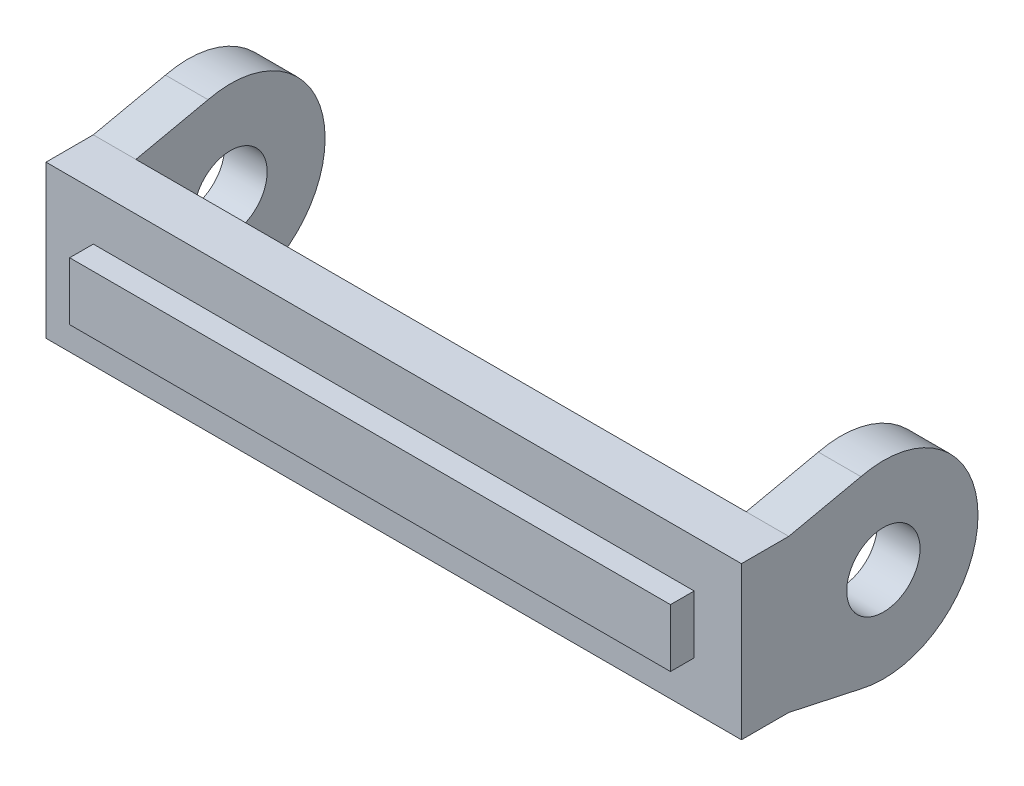
from build123d import *

# Parameters (mm, degrees)
CROQUIS1_W                 = 26.4
CROQUIS1_H                 = 2.95
SALIENTE_EXTRUIR1_DEPTH    = 1.5
SALIENTE_EXTRUIR2_DEPTH    = 1
SALIENTE_EXTRUIR3_START    = 1
SALIENTE_EXTRUIR3_DEPTH    = 1
CROQUIS5_W                 = 26.4
CROQUIS5_H                 = 0.387649526
SALIENTE_EXTRUIR4_DEPTH    = 2.95
CROQUIS7_R                 = 1.5
CORTAR_EXTRUIR1_DEPTH      = 51
CORTAR_EXTRUIR2_START      = 26.4
CROQUIS8_R                 = 3
CORTAR_EXTRUIR2_DEPTH      = 26.4
CROQUIS9_W                 = 0.5
CROQUIS9_H                 = 1
SALIENTE_EXTRUIR5_DEPTH    = 20
CROQUIS11_W                = 1
CROQUIS11_H                = 1.007194245
CROQUIS11_H_2              = 16.042805755
CORTAR_EXTRUIR3_DEPTH      = 40
CROQUIS13_W                = 25.4
CROQUIS13_H                = 2.45
SALIENTE_EXTRUIR6_DEPTH    = 1
CROQUIS14_W                = 4.527159606
CROQUIS14_H                = 1.589204257
CROQUIS14_W_2              = 3.32574087
CROQUIS14_H_2              = 2.189079922
CORTAR_EXTRUIR4_DEPTH      = 21
CORTAR_EXTRUIR5_DEPTH      = 21
CORTAR_EXTRUIR5_DEPTH_BACK = 21
CROQUIS16_W                = 34.398488571
CROQUIS16_H                = 9.421589472
CROQUIS17_W                = 29.4
CROQUIS17_H                = 6.45
SALIENTE_EXTRUIR7_DEPTH    = 2
CROQUIS18_R                = 1.55
SALIENTE_EXTRUIR8_DEPTH    = 29.4
CORTAR_EXTRUIR6_DEPTH      = 12
CORTAR_EXTRUIR6_DEPTH_BACK = 32
CROQUIS19_W                = 25.8
CROQUIS19_H                = 10.578979108


with BuildPart() as part:
    # Croquis1 → Saliente-Extruir1 (new body)
    with BuildSketch(Plane.XY):
        with Locations((-22.767073783, 17.517805755)):
            Rectangle(CROQUIS1_W, CROQUIS1_H)
    extrude(amount=SALIENTE_EXTRUIR1_DEPTH)

    # Croquis2 → Saliente-Extruir2 (add)
    with BuildSketch(Plane(origin=(-9.567073783, 0, 0), x_dir=(0, 0, -1), z_dir=(1, 0, 0))):
        with BuildLine():
            Line((0, 18.992805755), (0.387649526, 18.992805755))
            ThreePointArc((0.387649526, 18.992805755), (6, 17.517805755), (0.387649526, 16.042805755))
            Line((0.387649526, 16.042805755), (0, 16.042805755))
            Line((0, 16.042805755), (-0.5, 16.042805755))
            Line((-0.5, 16.042805755), (-0.5, 18.992805755))
            Line((-0.5, 18.992805755), (0, 18.992805755))
        make_face()
    extrude(amount=SALIENTE_EXTRUIR2_DEPTH)

    # Croquis3 → Saliente-Extruir3 (add)
    with BuildSketch(Plane.ZY.offset(35.967073783).offset(SALIENTE_EXTRUIR3_START)):
        with BuildLine():
            Line((0.5, 18.992805755), (-0.387649526, 18.992805755))
            ThreePointArc((-0.387649526, 18.992805755), (-6, 17.517805755), (-0.387649526, 16.042805755))
            Line((-0.387649526, 16.042805755), (0.5, 16.042805755))
            Line((0.5, 16.042805755), (0.5, 18.992805755))
        make_face()
    extrude(amount=-SALIENTE_EXTRUIR3_DEPTH)

    # Croquis5 → Saliente-Extruir4 (add)
    with BuildSketch(Plane(origin=(0, 18.992805755, 0), x_dir=(1, 0, 0), z_dir=(0, 1, 0))):
        with Locations((-22.767073783, 0.193824763)):
            Rectangle(CROQUIS5_W, CROQUIS5_H)
    extrude(amount=-SALIENTE_EXTRUIR4_DEPTH)

    # Croquis7 → Cortar-Extruir1 (cut)
    with BuildSketch(Plane(origin=(-8.567073783, 0, 0), x_dir=(0, 0, -1), z_dir=(1, 0, 0))):
        with Locations(Location((3, 17.517805755, 0), (0, 0, 180))):
            Circle(CROQUIS7_R)
    extrude(amount=-CORTAR_EXTRUIR1_DEPTH, mode=Mode.SUBTRACT)

    # Croquis8 → Cortar-Extruir2 (cut)
    with BuildSketch(Plane.ZY.offset(9.567073783).offset(CORTAR_EXTRUIR2_START)):
        with Locations((-3, 17.517805755)):
            Circle(CROQUIS8_R)
    extrude(amount=-CORTAR_EXTRUIR2_DEPTH, mode=Mode.SUBTRACT)

    # Croquis9 → Saliente-Extruir5 (add)
    with BuildSketch(Plane(origin=(0, 0, 0), x_dir=(1, 0, 0), z_dir=(0, 1, 0))):
        with Locations((-37.017073783, -1)):
            Rectangle(CROQUIS9_W, CROQUIS9_H)
        with Locations((-8.518741189, -1)):
            Rectangle(CROQUIS9_W, CROQUIS9_H)
    extrude(amount=SALIENTE_EXTRUIR5_DEPTH)

    # Croquis11 → Cortar-Extruir3 (cut)
    with BuildSketch(Plane.ZY.offset(37.267073783)):
        with Locations((1, 19.496402878)):
            Rectangle(CROQUIS11_W, CROQUIS11_H)
        with Locations((1, 8.021402877)):
            Rectangle(CROQUIS11_W, CROQUIS11_H_2)
    extrude(amount=-CORTAR_EXTRUIR3_DEPTH, mode=Mode.SUBTRACT)

    # Croquis13 → Saliente-Extruir6 (add)
    with BuildSketch(Plane.XY.offset(1.5)):
        with Locations((-22.767073783, 17.517805755)):
            Rectangle(CROQUIS13_W, CROQUIS13_H)
    extrude(amount=SALIENTE_EXTRUIR6_DEPTH)

    # Croquis14 → Cortar-Extruir4 (cut)
    with BuildSketch(Plane(origin=(0, 18.992805755, 0), x_dir=(1, 0, 0), z_dir=(0, 1, 0))):
        with Locations((-38.230653586, -1.294602129)):
            Rectangle(CROQUIS14_W, CROQUIS14_H)
        with Locations((-7.904203348, -1.594539961)):
            Rectangle(CROQUIS14_W_2, CROQUIS14_H_2)
    extrude(amount=-CORTAR_EXTRUIR4_DEPTH, mode=Mode.SUBTRACT)

    # Croquis16 → Cortar-Extruir5 (cut, two sides: drawn at the far end of the back side and taken through both)
    with BuildSketch(Plane(origin=(0, 18.992805755, 0), x_dir=(1, 0, 0), z_dir=(0, 1, 0)).offset(-CORTAR_EXTRUIR5_DEPTH_BACK)):
        with Locations((-24.715099431, 3.210794736)):
            Rectangle(CROQUIS16_W, CROQUIS16_H)
    extrude(amount=CORTAR_EXTRUIR5_DEPTH + CORTAR_EXTRUIR5_DEPTH_BACK, mode=Mode.SUBTRACT)

    # Croquis17 → Saliente-Extruir7 (add)
    with BuildSketch(Plane(origin=(0, 0, 1.5), x_dir=(-1, 0, 0), z_dir=(0, 0, -1))):
        with Locations((22.767073783, 17.517805755)):
            Rectangle(CROQUIS17_W, CROQUIS17_H)
    extrude(amount=SALIENTE_EXTRUIR7_DEPTH)

    # Croquis18 → Saliente-Extruir8 (add)
    with BuildSketch(Plane(origin=(-8.067073783, 0, 0), x_dir=(0, 0, -1), z_dir=(1, 0, 0))):
        with BuildLine():
            Line((0.5, 20.742805755), (3.55055626, 21.40349187))
            ThreePointArc((3.55055626, 21.40349187), (8.5, 17.517805755), (3.55055626, 13.63211964))
            Line((3.55055626, 13.63211964), (0.5, 14.292805755))
            Line((0.5, 14.292805755), (0.5, 20.742805755))
        make_face()
        with Locations((4.5, 17.517805755)):
            Circle(CROQUIS18_R, mode=Mode.SUBTRACT)
    extrude(amount=-SALIENTE_EXTRUIR8_DEPTH)

    # Croquis19 → Cortar-Extruir6 (cut, two sides: drawn at the far end of the back side and taken through both)
    with BuildSketch(Plane(origin=(0, 20.742805755, 0), x_dir=(1, 0, 0), z_dir=(0, 1, 0)).offset(-CORTAR_EXTRUIR6_DEPTH_BACK)):
        with Locations((-22.767073783, 5.789489554)):
            Rectangle(CROQUIS19_W, CROQUIS19_H)
    extrude(amount=CORTAR_EXTRUIR6_DEPTH + CORTAR_EXTRUIR6_DEPTH_BACK, mode=Mode.SUBTRACT)


solid = part.part
